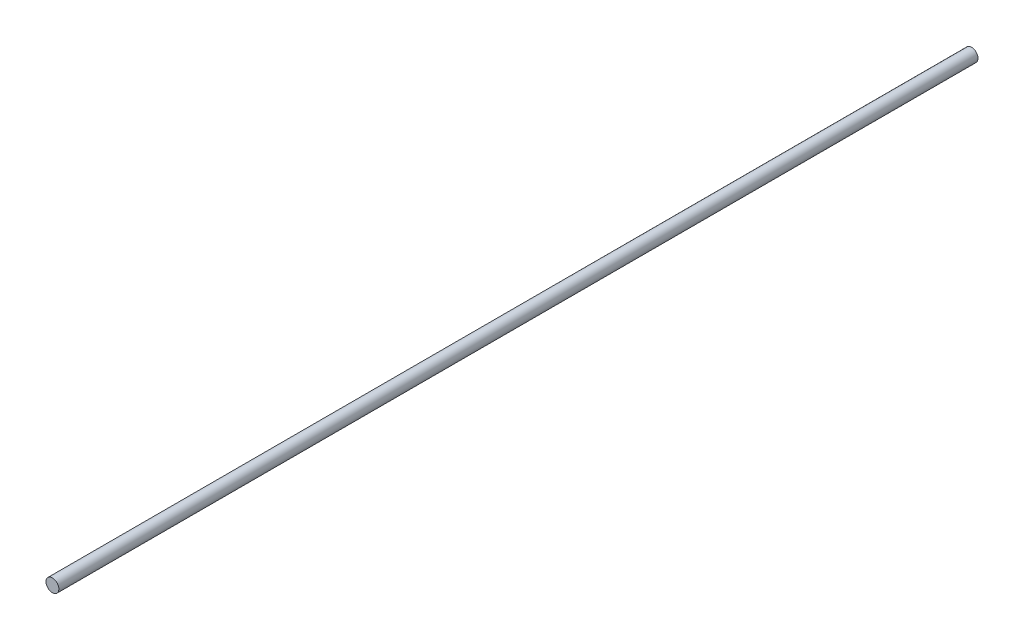
from build123d import *

# Parameters (mm, degrees)
CROQUIS1_R              = 3.5
SALIENTE_EXTRUIR1_DEPTH = 500


with BuildPart() as part:
    # Croquis1 → Saliente-Extruir1 (new body)
    with BuildSketch(Plane.XY):
        Circle(CROQUIS1_R)
    extrude(amount=SALIENTE_EXTRUIR1_DEPTH)


solid = part.part
